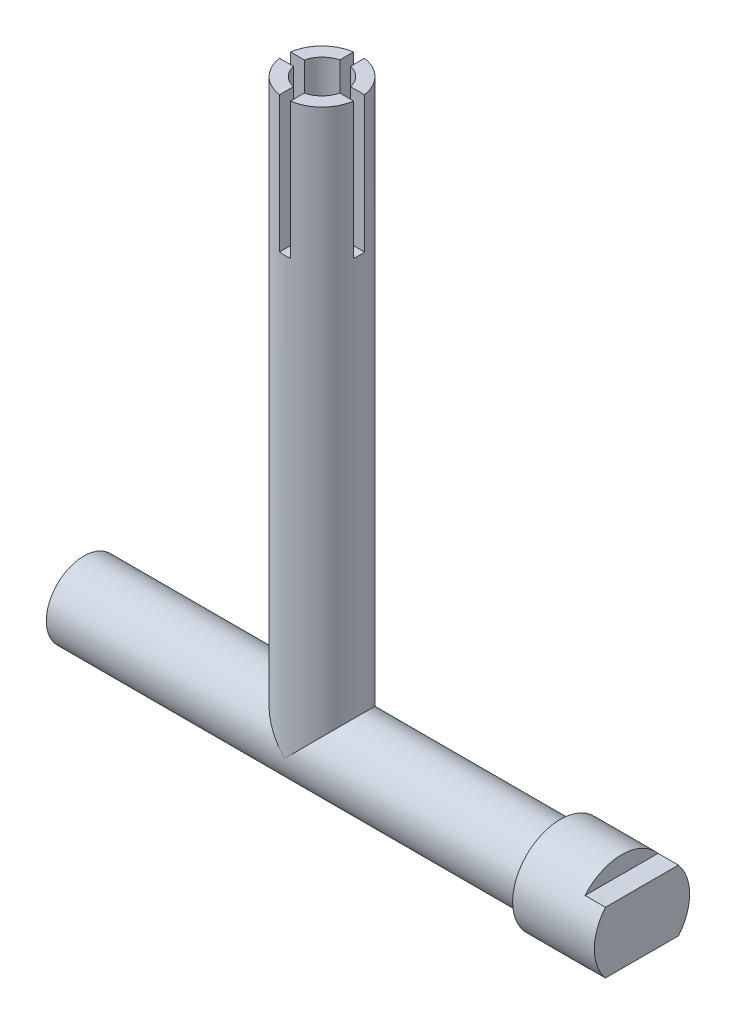
from build123d import *

# Parameters (mm, degrees)
SKETCH_1_R                  = 2.75
EXTRUDE_1_DEPTH             = 35
SKETCH_2_R                  = 2.75
EXTRUDE_2_DEPTH             = 42
HOLE_WIZARD_3_5_3_5_1_D     = 3.5
HOLE_WIZARD_3_5_3_5_1_DEPTH = 13
HOLE_WIZARD_3_5_3_5_1_TIP   = 1.051506083
CUT_EXTRUDE_START           = -10
SKETCH_4_W                  = 0.8
SKETCH_4_H                  = 0.8
CUT_EXTRUDE_1_DEPTH         = 10
SKETCH_5_R                  = 3.5
EXTRUDE_3_DEPTH             = 6
CUT_EXTRUDE_START_2         = -1.5
CUT_EXTRUDE_2_DEPTH         = 1.5
SKETCH_7_R                  = 2
CUT_EXTRUDE_3_DEPTH         = 7
M2_5X0_451_D                = 2.05
M2_5X0_451_DEPTH            = 6
M2_5X0_451_TIP              = 0.615882135


with BuildPart() as part:
    # Эскиз1 → Бобышка-Вытянуть1 (new body)
    with BuildSketch(Plane(origin=(0, 0, 0), x_dir=(0, 0, -1), z_dir=(1, 0, 0))):
        Circle(SKETCH_1_R)
    extrude(amount=EXTRUDE_1_DEPTH)

    # Эскиз2 → Бобышка-Вытянуть2 (add)
    with BuildSketch(Plane(origin=(0, 0, 0), x_dir=(1, 0, 0), z_dir=(0, 1, 0))):
        with Locations(Location((17.5, 0, 0), (0, 0, 270))):
            Circle(SKETCH_2_R)
    extrude(amount=EXTRUDE_2_DEPTH)

    # Диаметр отверстия Ø3.5 (3.5)1
    with Locations(Plane(origin=(17.5, 42, 0), x_dir=(0, 0, 1), z_dir=(0, 1, 0))):
        with Locations((0, 0)):
            Hole(HOLE_WIZARD_3_5_3_5_1_D / 2, depth=HOLE_WIZARD_3_5_3_5_1_DEPTH)
            with Locations((0, 0, -(HOLE_WIZARD_3_5_3_5_1_DEPTH + HOLE_WIZARD_3_5_3_5_1_TIP / 2))):  # 118° drill point
                Cone(0, HOLE_WIZARD_3_5_3_5_1_D / 2, HOLE_WIZARD_3_5_3_5_1_TIP, mode=Mode.SUBTRACT)

    # Эскиз4 → Вырез-Вытянуть1 (cut)
    with BuildSketch(Plane(origin=(0, 42, 0), x_dir=(1, 0, 0), z_dir=(0, 1, 0)).offset(CUT_EXTRUDE_START)):
        with BuildLine():
            Line((17.1, 4), (17.1, 2.720753572))
            ThreePointArc((17.1, 2.720753572), (17.5, 2.75), (17.9, 2.720753572))
            Line((17.9, 2.720753572), (17.9, 4))
            Line((17.9, 4), (17.1, 4))
        make_face()
        with BuildLine():
            Line((17.1, -1.703672504), (17.1, -2.720753572))
            ThreePointArc((17.1, -2.720753572), (17.5, -2.75), (17.9, -2.720753572))
            Line((17.9, -2.720753572), (17.9, -1.703672504))
            ThreePointArc((17.9, -1.703672504), (17.5, -1.75), (17.1, -1.703672504))
        make_face()
        with BuildLine():
            ThreePointArc((17.9, 2.720753572), (17.5, 2.75), (17.1, 2.720753572))
            Line((17.1, 2.720753572), (17.1, 1.703672504))
            ThreePointArc((17.1, 1.703672504), (17.5, 1.75), (17.9, 1.703672504))
            Line((17.9, 1.703672504), (17.9, 2.720753572))
        make_face()
        with BuildLine():
            Line((17.1, 1.703672504), (17.1, 0.4))
            Line((17.1, 0.4), (17.9, 0.4))
            Line((17.9, 0.4), (17.9, 1.703672504))
            ThreePointArc((17.9, 1.703672504), (17.5, 1.75), (17.1, 1.703672504))
        make_face()
        with Locations((17.5, 0)):
            Rectangle(SKETCH_4_W, SKETCH_4_H)
        with BuildLine():
            Line((15.796327496, -0.4), (17.1, -0.4))
            Line((17.1, -0.4), (17.1, 0.4))
            Line((17.1, 0.4), (15.796327496, 0.4))
            ThreePointArc((15.796327496, 0.4), (15.75, 0), (15.796327496, -0.4))
        make_face()
        with BuildLine():
            ThreePointArc((14.779246428, 0.4), (14.75, 0), (14.779246428, -0.4))
            Line((14.779246428, -0.4), (15.796327496, -0.4))
            ThreePointArc((15.796327496, -0.4), (15.75, 0), (15.796327496, 0.4))
            Line((15.796327496, 0.4), (14.779246428, 0.4))
        make_face()
        with BuildLine():
            Line((19.203672504, -0.4), (20.220753572, -0.4))
            ThreePointArc((20.220753572, -0.4), (20.242678647, -0.200533883), (20.25, 0))
            ThreePointArc((20.25, 0), (20.242678647, 0.200533883), (20.220753572, 0.4))
            Line((20.220753572, 0.4), (19.203672504, 0.4))
            ThreePointArc((19.203672504, 0.4), (19.238379545, 0.20133693), (19.25, 0))
            ThreePointArc((19.25, 0), (19.238379545, -0.20133693), (19.203672504, -0.4))
        make_face()
        with BuildLine():
            Line((13.5, -0.4), (14.779246428, -0.4))
            ThreePointArc((14.779246428, -0.4), (14.75, 0), (14.779246428, 0.4))
            Line((14.779246428, 0.4), (13.5, 0.4))
            Line((13.5, 0.4), (13.5, -0.4))
        make_face()
        with BuildLine():
            Line((17.1, -0.4), (17.1, -1.703672504))
            ThreePointArc((17.1, -1.703672504), (17.5, -1.75), (17.9, -1.703672504))
            Line((17.9, -1.703672504), (17.9, -0.4))
            Line((17.9, -0.4), (17.1, -0.4))
        make_face()
        with BuildLine():
            Line((17.1, -2.720753572), (17.1, -4))
            Line((17.1, -4), (17.9, -4))
            Line((17.9, -4), (17.9, -2.720753572))
            ThreePointArc((17.9, -2.720753572), (17.5, -2.75), (17.1, -2.720753572))
        make_face()
        with BuildLine():
            Line((17.9, 0.4), (17.9, -0.4))
            Line((17.9, -0.4), (19.203672504, -0.4))
            ThreePointArc((19.203672504, -0.4), (19.238379545, -0.20133693), (19.25, 0))
            ThreePointArc((19.25, 0), (19.238379545, 0.20133693), (19.203672504, 0.4))
            Line((19.203672504, 0.4), (17.9, 0.4))
        make_face()
        with BuildLine():
            ThreePointArc((20.25, 0), (20.242678647, -0.200533883), (20.220753572, -0.4))
            Line((20.220753572, -0.4), (21.5, -0.4))
            Line((21.5, -0.4), (21.5, 0.4))
            Line((21.5, 0.4), (20.220753572, 0.4))
            ThreePointArc((20.220753572, 0.4), (20.242678647, 0.200533883), (20.25, 0))
        make_face()
    extrude(amount=CUT_EXTRUDE_1_DEPTH, mode=Mode.SUBTRACT)

    # Эскиз5 → Бобышка-Вытянуть3 (add)
    with BuildSketch(Plane(origin=(35, 0, 0), x_dir=(0, 0, -1), z_dir=(1, 0, 0))):
        Circle(SKETCH_5_R)
    extrude(amount=EXTRUDE_3_DEPTH)

    # Эскиз6 → Вырез-Вытянуть2 (cut)
    with BuildSketch(Plane(origin=(41, 0, 0), x_dir=(0, 0, -1), z_dir=(1, 0, 0)).offset(CUT_EXTRUDE_START_2)):
        with BuildLine():
            ThreePointArc((2.680951324, 2.25), (0, 3.5), (-2.680951324, 2.25))
            Line((-2.680951324, 2.25), (2.680951324, 2.25))
        make_face()
        with BuildLine():
            Line((2.680951324, -2.25), (-2.680951324, -2.25))
            ThreePointArc((-2.680951324, -2.25), (0, -3.5), (2.680951324, -2.25))
        make_face()
    extrude(amount=CUT_EXTRUDE_2_DEPTH, mode=Mode.SUBTRACT)

    # Эскиз7 → Вырез-Вытянуть3 (cut)
    with BuildSketch(Plane.ZY):
        Circle(SKETCH_7_R)
    extrude(amount=-CUT_EXTRUDE_3_DEPTH, mode=Mode.SUBTRACT)

    # Отверстие обработанное метчиком M2.5x0.451
    with Locations(Plane(origin=(7, 0, 0), x_dir=(0, 0, -1), z_dir=(-1, 0, 0))):
        with Locations((0, 0)):
            Hole(M2_5X0_451_D / 2, depth=M2_5X0_451_DEPTH)
            with Locations((0, 0, -(M2_5X0_451_DEPTH + M2_5X0_451_TIP / 2))):  # 118° drill point
                Cone(0, M2_5X0_451_D / 2, M2_5X0_451_TIP, mode=Mode.SUBTRACT)


solid = part.part
